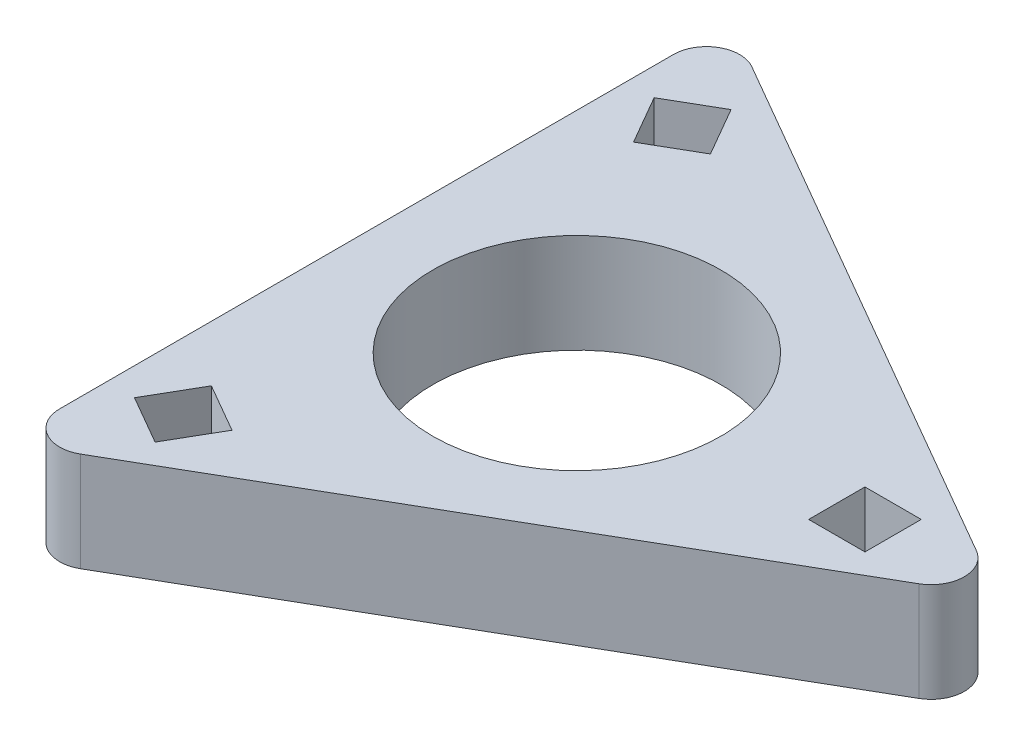
from build123d import *

# Parameters (mm, degrees)
SKETCH2_R           = 21.754264805
SKETCH2_W           = 8.5
SKETCH2_H           = 8.5
BOSS_EXTRUDE2_DEPTH = 15
FILLET2_R           = 5


with BuildPart() as part:
    # Sketch2 → Boss-Extrude2 (new body)
    with BuildSketch(Plane(origin=(0, 0, 0), x_dir=(1, 0, 0), z_dir=(0, 1, 0))):
        Polygon((184.942144259, 95.410610484), (89.679349842, 150.410610484), (89.679349842, 40.410610484), align=None)
        with Locations(Location((121.433614648, 95.410610484, 0), (0, 0, 270))):
            Circle(SKETCH2_R, mode=Mode.SUBTRACT)
        Polygon((105.484957808, 59.286726526), (98.123741876, 63.536726526), (93.873741876, 56.175510594), (101.234957808, 51.925510594), align=None, mode=Mode.SUBTRACT)
        with Locations((164.942144259, 95.410610484)):
            Rectangle(SKETCH2_W, SKETCH2_H, mode=Mode.SUBTRACT)
        Polygon((105.484957808, 131.534494442), (101.234957808, 138.895710374), (93.873741876, 134.645710374), (98.123741876, 127.284494442), align=None, mode=Mode.SUBTRACT)
    extrude(amount=BOSS_EXTRUDE2_DEPTH)

    # Fillet2
    fillet2_edges = [part.edges().sort_by_distance(p)[0] for p in [
        (89.679349842, 7.5, -40.410610484),
        (89.679349842, 7.5, -150.410610484),
        (184.942144259, 7.5, -95.410610484),
    ]]
    fillet(fillet2_edges, radius=FILLET2_R)


solid = part.part
